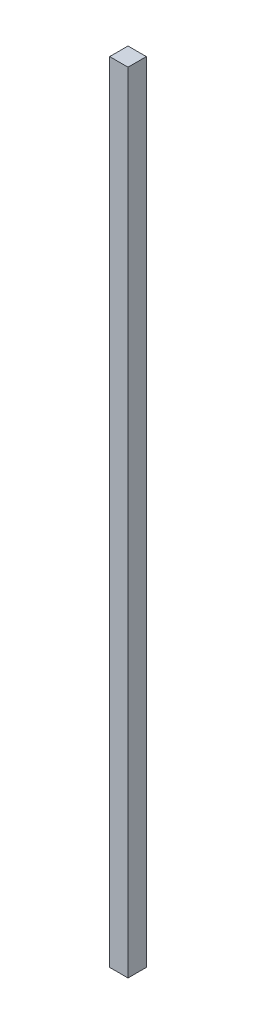
from build123d import *

# Parameters (mm, degrees)
SKETCH1_W           = 20
SKETCH1_H           = 20
BOSS_EXTRUDE1_DEPTH = 860


with BuildPart() as part:
    # Sketch1 → Boss-Extrude1 (new body)
    with BuildSketch(Plane(origin=(0, 0, 0), x_dir=(1, 0, 0), z_dir=(0, 1, 0))):
        Rectangle(SKETCH1_W, SKETCH1_H)
    extrude(amount=BOSS_EXTRUDE1_DEPTH)


solid = part.part
